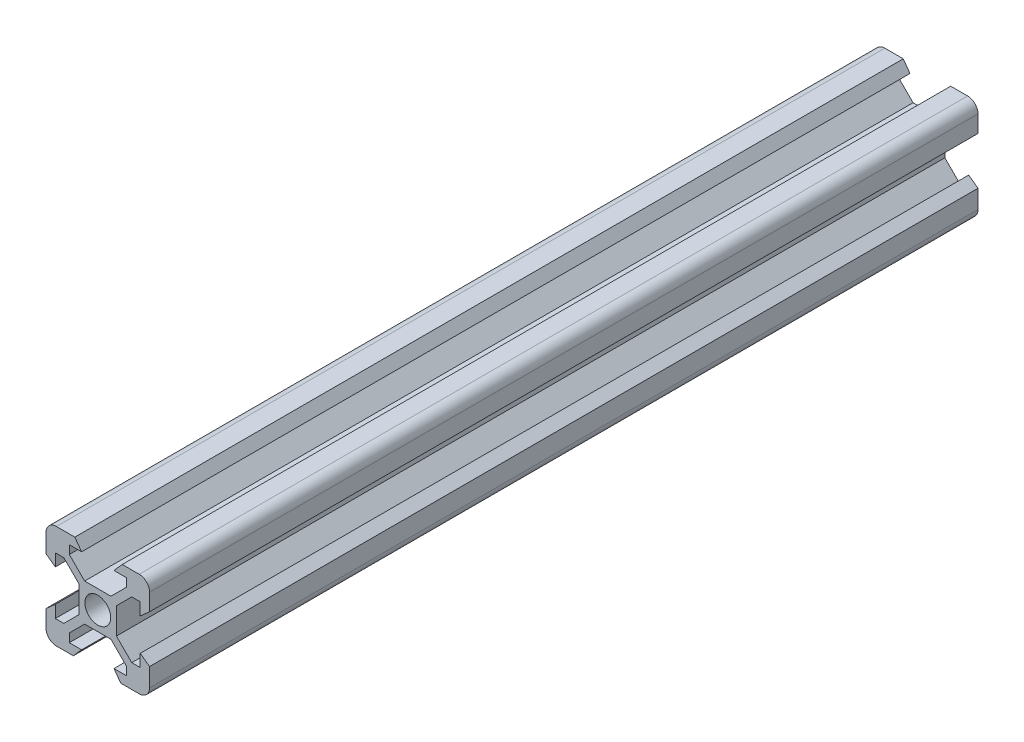
from build123d import *

# Parameters (mm, degrees)
SKETCH1_R           = 2.5
BOSS_EXTRUDE1_DEPTH = 160


with BuildPart() as part:
    # Sketch1 → Boss-Extrude1 (new body)
    with BuildSketch(Plane.XY):
        with BuildLine():
            Line((-4.725542729, -10), (-3.125, -8.2))
            Line((-3.125, -8.2), (-5.5, -8.2))
            Line((-5.5, -8.2), (-5.5, -6.560660172))
            Line((-5.5, -6.560660172), (-2.539339828, -3.6))
            Line((-2.539339828, -3.6), (2.539339828, -3.6))
            Line((2.539339828, -3.6), (5.5, -6.560660172))
            Line((5.5, -6.560660172), (5.5, -8.2))
            Line((5.5, -8.2), (3.125, -8.2))
            Line((3.125, -8.2), (4.434457271, -10))
            Line((4.434457271, -10), (8, -10))
            ThreePointArc((8, -10), (9.414213562, -9.414213562), (10, -8))
            Line((10, -8), (10, -4.434457271))
            Line((10, -4.434457271), (8.2, -3.125))
            Line((8.2, -3.125), (8.2, -5.5))
            Line((8.2, -5.5), (6.560660172, -5.5))
            Line((6.560660172, -5.5), (3.6, -2.539339828))
            Line((3.6, -2.539339828), (3.6, 2.539339828))
            Line((3.6, 2.539339828), (6.560660172, 5.5))
            Line((6.560660172, 5.5), (8.2, 5.5))
            Line((8.2, 5.5), (8.2, 3.125))
            Line((8.2, 3.125), (10, 4.725542729))
            Line((10, 4.725542729), (10, 8))
            ThreePointArc((10, 8), (9.414213562, 9.414213562), (8, 10))
            Line((8, 10), (4.725542729, 10))
            Line((4.725542729, 10), (3.125, 8.2))
            Line((3.125, 8.2), (5.5, 8.2))
            Line((5.5, 8.2), (5.5, 6.560660172))
            Line((5.5, 6.560660172), (2.539339828, 3.6))
            Line((2.539339828, 3.6), (-2.539339828, 3.6))
            Line((-2.539339828, 3.6), (-5.5, 6.560660172))
            Line((-5.5, 6.560660172), (-5.5, 8.2))
            Line((-5.5, 8.2), (-3.125, 8.2))
            Line((-3.125, 8.2), (-4.434457271, 10))
            Line((-4.434457271, 10), (-8, 10))
            ThreePointArc((-8, 10), (-9.414213562, 9.414213562), (-10, 8))
            Line((-10, 8), (-10, 4.434457271))
            Line((-10, 4.434457271), (-8.2, 3.125))
            Line((-8.2, 3.125), (-8.2, 5.5))
            Line((-8.2, 5.5), (-6.560660172, 5.5))
            Line((-6.560660172, 5.5), (-3.6, 2.539339828))
            Line((-3.6, 2.539339828), (-3.6, -2.539339828))
            Line((-3.6, -2.539339828), (-6.560660172, -5.5))
            Line((-6.560660172, -5.5), (-8.2, -5.5))
            Line((-8.2, -5.5), (-8.2, -3.125))
            Line((-8.2, -3.125), (-10, -4.725542729))
            Line((-10, -4.725542729), (-10, -8))
            ThreePointArc((-10, -8), (-9.414213562, -9.414213562), (-8, -10))
            Line((-8, -10), (-4.725542729, -10))
        make_face()
        Circle(SKETCH1_R, mode=Mode.SUBTRACT)
    extrude(amount=BOSS_EXTRUDE1_DEPTH)


solid = part.part
